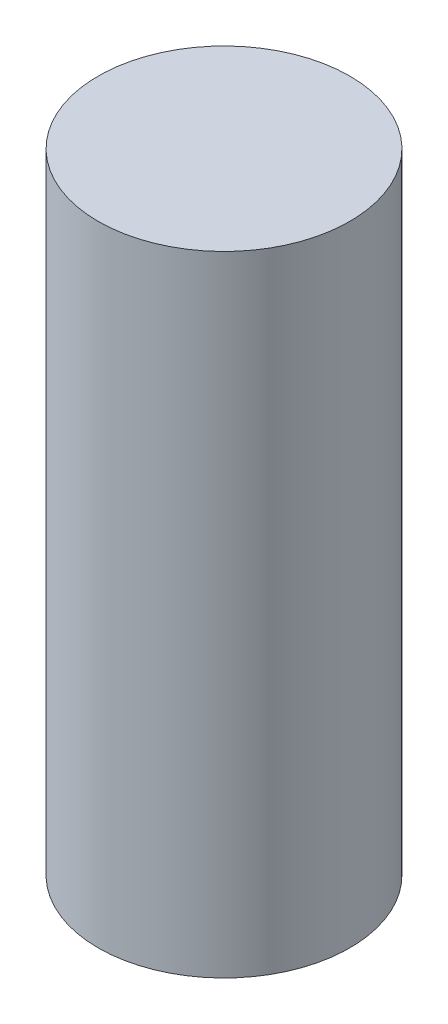
from build123d import *

# Parameters (mm, degrees)
SKETCH1_R           = 63.5
BOSS_EXTRUDE1_DEPTH = 317.5


with BuildPart() as part:
    # Sketch1 → Boss-Extrude1 (new body)
    with BuildSketch(Plane(origin=(0, 0, 0), x_dir=(1, 0, 0), z_dir=(0, 1, 0))):
        with Locations(Location((0, 0, 0), (0, 0, 90))):
            Circle(SKETCH1_R)
    extrude(amount=BOSS_EXTRUDE1_DEPTH)


solid = part.part
